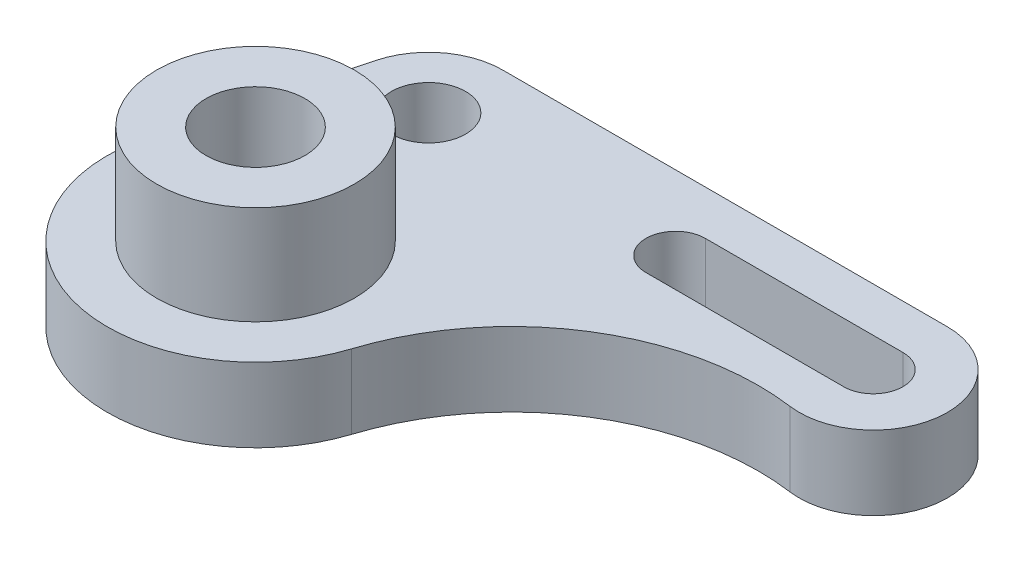
from build123d import *

# Parameters (mm, degrees)
BOSS_EXTRUDE1_DEPTH = 15
SKETCH7_R           = 20
BOSS_EXTRUDE2_DEPTH = 20
SKETCH8_R           = 7.5
CUT_EXTRUDE1_DEPTH  = 15
SKETCH9_R           = 10
CUT_EXTRUDE2_DEPTH  = 35


with BuildPart() as part:
    # Sketch1 → Boss-Extrude1 (new body)
    with BuildSketch(Plane(origin=(0, 0, 0), x_dir=(1, 0, 0), z_dir=(0, 1, 0))):
        with BuildLine():
            Line((-59.507658043, 23.811542745), (-69.015316087, -12.376914511))
            ThreePointArc((-69.015316087, -12.376914511), (-48.389479092, -48.803066513), (-11.429422304, -29.149977603))
            ThreePointArc((-11.429422304, -29.149977603), (9.525739839, -2.102034478), (42.966509351, 5.138475321))
            ThreePointArc((42.966509351, 5.138475321), (59.965341128, 18.980899952), (45, 35))
            Line((45, 35), (-45, 35))
            ThreePointArc((-45, 35), (-54.16042736, 31.877986807), (-59.507658043, 23.811542745))
        make_face()
    extrude(amount=BOSS_EXTRUDE1_DEPTH)

    # Sketch7 → Boss-Extrude2 (add)
    with BuildSketch(Plane(origin=(0, 15, 0), x_dir=(1, 0, 0), z_dir=(0, 1, 0))):
        with Locations(Location((-40, -20, 0), (0, 0, 270))):
            Circle(SKETCH7_R)
    extrude(amount=BOSS_EXTRUDE2_DEPTH)

    # Sketch8 → Cut-Extrude1 (cut)
    with BuildSketch(Plane(origin=(0, 15, 0), x_dir=(1, 0, 0), z_dir=(0, 1, 0))):
        with Locations(Location((-45, 20, 0), (0, 0, 270))):
            Circle(SKETCH8_R)
        with BuildLine():
            Line((5, 26), (45, 26))
            ThreePointArc((45, 26), (51, 20), (45, 14))
            Line((45, 14), (5, 14))
            ThreePointArc((5, 14), (-1, 20), (5, 26))
        make_face()
    extrude(amount=-CUT_EXTRUDE1_DEPTH, mode=Mode.SUBTRACT)

    # Sketch9 → Cut-Extrude2 (cut)
    with BuildSketch(Plane(origin=(0, 35, 0), x_dir=(1, 0, 0), z_dir=(0, 1, 0))):
        with Locations(Location((-40, -20, 0), (0, 0, 270))):
            Circle(SKETCH9_R)
    extrude(amount=-CUT_EXTRUDE2_DEPTH, mode=Mode.SUBTRACT)


solid = part.part
